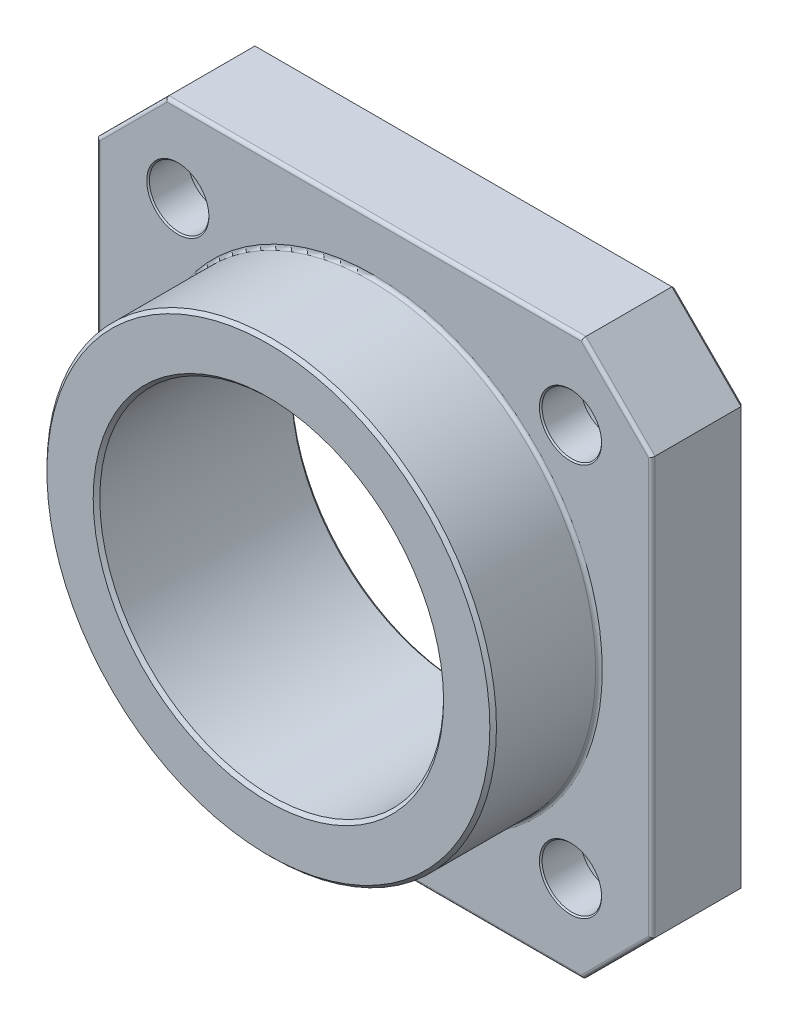
from build123d import *

# Parameters (mm, degrees)
SCHIZZO1_R                   = 13
ESTRUSIONE_ESTRUSIONE1_DEPTH = 7
SCHIZZO2_R                   = 17
SCHIZZO2_R_2                 = 13
ESTRUSIONE_ESTRUSIONE2_DEPTH = 8
SMUSSO1_SIZE                 = 0.25
SMUSSO2_SIZE                 = 0.25
RACCORDO1_R                  = 0.25
RACCORDO2_R                  = 0.25
SCHIZZO3_R                   = 2.25
TAGLIO_ESTRUSIONE1_DEPTH     = 34.271609519
SCHIZZO4_R                   = 4
TAGLIO_ESTRUSIONE2_DEPTH     = 4
RIPETIZIONECIRCOLARE1_COUNT  = 4
SMUSSO3_SIZE                 = 0.1


with BuildPart() as part:
    # Schizzo1 → Estrusione-Estrusione1 (new body)
    with BuildSketch(Plane.XY):
        Polygon((-21, 15.769552622), (-15.769552622, 21), (15.769552622, 21), (21, 15.769552622), (21, -15.769552622), (15.769552622, -21), (-15.769552622, -21), (-21, -15.769552622), align=None)
        Circle(SCHIZZO1_R, mode=Mode.SUBTRACT)
    extrude(amount=ESTRUSIONE_ESTRUSIONE1_DEPTH)

    # Schizzo2 → Estrusione-Estrusione2 (add)
    with BuildSketch(Plane.XY.offset(7)):
        Circle(SCHIZZO2_R)
        Circle(SCHIZZO2_R_2, mode=Mode.SUBTRACT)
    extrude(amount=ESTRUSIONE_ESTRUSIONE2_DEPTH)

    # Smusso1
    smusso1_edges = [part.edges().sort_by_distance(p)[0] for p in [
        (-13, 0, 0),
        (0, 21, 0),
        (-18.384776311, 18.384776311, 0),
        (-21, 0, 0),
        (-18.384776311, -18.384776311, 0),
        (0, -21, 0),
        (18.384776311, -18.384776311, 0),
        (21, 0, 0),
        (18.384776311, 18.384776311, 0),
    ]]
    chamfer(smusso1_edges, length=SMUSSO1_SIZE)

    # Smusso2
    smusso2_edges = [part.edges().sort_by_distance(p)[0] for p in [
        (-13, 0, 15),
        (-17, 0, 15),
    ]]
    chamfer(smusso2_edges, length=SMUSSO2_SIZE)

    # Raccordo1
    raccordo1_edges = [part.edges().sort_by_distance(p)[0] for p in [
        (-17, 0, 7),
    ]]
    fillet(raccordo1_edges, radius=RACCORDO1_R)

    # Raccordo2
    raccordo2_edges = [part.edges().sort_by_distance(p)[0] for p in [
        (21, 0, 7),
        (18.384776311, -18.384776311, 7),
        (0, -21, 7),
        (-18.384776311, -18.384776311, 7),
        (-21, 0, 7),
        (-18.384776311, 18.384776311, 7),
        (0, 21, 7),
        (18.384776311, 18.384776311, 7),
    ]]
    fillet(raccordo2_edges, radius=RACCORDO2_R)

    # Schizzo3 → Taglio-Estrusione1 (cut, through all)
    with BuildSketch(Plane(origin=(0, 0, 0), x_dir=(-1, 0, 0), z_dir=(0, 0, -1))):
        with Locations((-14.849242405, 14.849242405)):
            Circle(SCHIZZO3_R)
    taglio_estrusione1 = extrude(amount=-TAGLIO_ESTRUSIONE1_DEPTH, mode=Mode.SUBTRACT)

    # Schizzo4 → Taglio-Estrusione2 (cut)
    with BuildSketch(Plane(origin=(0, 0, 0), x_dir=(-1, 0, 0), z_dir=(0, 0, -1))):
        with Locations((-14.849242405, 14.849242405)):
            Circle(SCHIZZO4_R)
    taglio_estrusione2 = extrude(amount=-TAGLIO_ESTRUSIONE2_DEPTH, mode=Mode.SUBTRACT)

    # RipetizioneCircolare1: Taglio-Estrusione1, Taglio-Estrusione2 ×4 about axis
    ripetizionecircolare1_axis = Axis((0, 0, 80.585678907), (0, 0, -1))
    add([taglio_estrusione1.rotate(ripetizionecircolare1_axis, i * 360 / RIPETIZIONECIRCOLARE1_COUNT) for i in range(1, RIPETIZIONECIRCOLARE1_COUNT)], mode=Mode.SUBTRACT)
    add([taglio_estrusione2.rotate(ripetizionecircolare1_axis, i * 360 / RIPETIZIONECIRCOLARE1_COUNT) for i in range(1, RIPETIZIONECIRCOLARE1_COUNT)], mode=Mode.SUBTRACT)

    # Smusso3
    smusso3_edges = [part.edges().sort_by_distance(p)[0] for p in [
        (14.849242405, -17.099242405, 7),
        (-17.099242405, -14.849242405, 7),
        (-14.849242405, 17.099242405, 7),
        (17.099242405, 14.849242405, 7),
        (18.849242405, 14.849242405, 0),
        (-14.849242405, 18.849242405, 0),
        (-18.849242405, -14.849242405, 0),
        (14.849242405, -18.849242405, 0),
    ]]
    chamfer(smusso3_edges, length=SMUSSO3_SIZE)


solid = part.part
